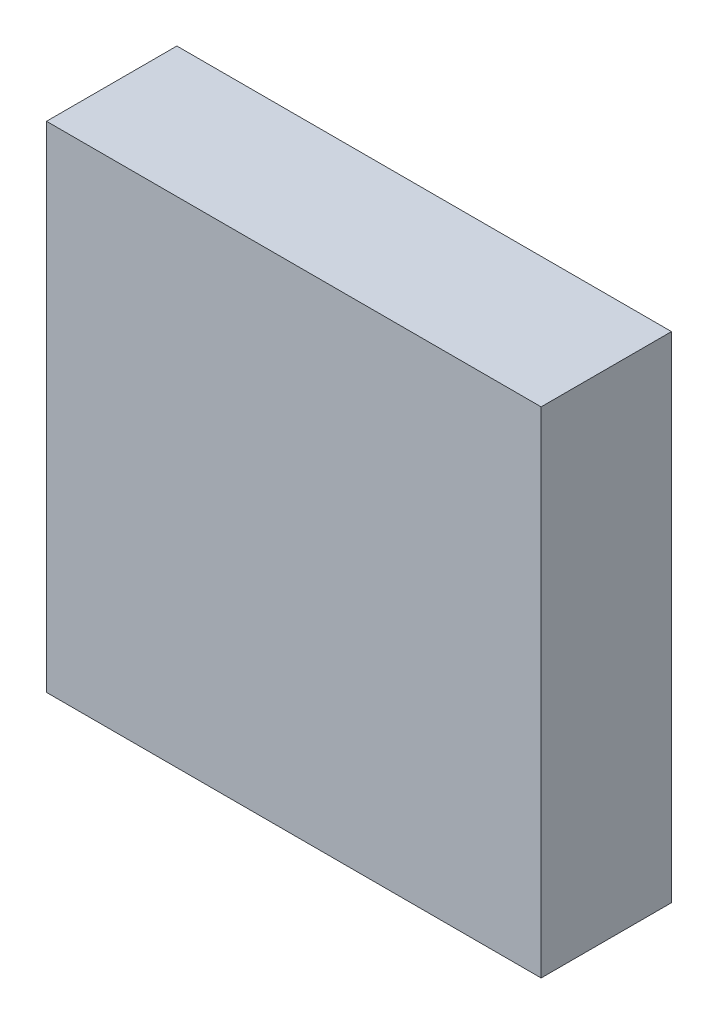
from build123d import *

# Parameters (mm, degrees)
SKETCH1_W               = 3.7941
SKETCH1_H               = 3.7941
COMPONENT_OUTLINE_DEPTH = 1


with BuildPart() as part:
    # Sketch1 → Component_Outline (new body)
    with BuildSketch(Plane.XY):
        with Locations((1.89705, 1.89705)):
            Rectangle(SKETCH1_W, SKETCH1_H)
    extrude(amount=COMPONENT_OUTLINE_DEPTH)


solid = part.part
